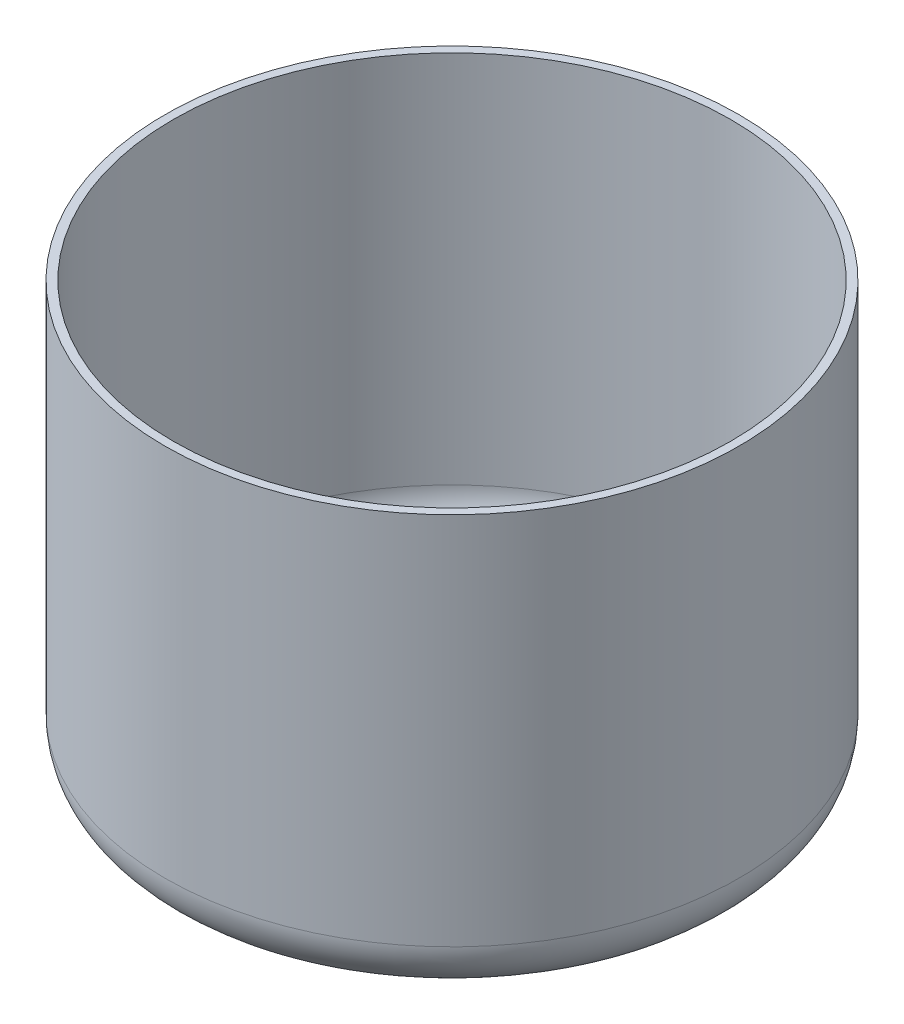
from build123d import *

# Parameters (mm, degrees)
SKETCH1_R           = 127
BOSS_EXTRUDE1_DEPTH = 190.5
FILLET1_R           = 20
SHELL1_T            = 3.81


with BuildPart() as part:
    # Sketch1 → Boss-Extrude1 (new body)
    with BuildSketch(Plane(origin=(0, 0, 0), x_dir=(1, 0, 0), z_dir=(0, 1, 0))):
        with Locations(Location((0, 0, 0), (0, 0, 270))):
            Circle(SKETCH1_R)
    extrude(amount=BOSS_EXTRUDE1_DEPTH)

    # Fillet1
    fillet1_edges = [part.edges().sort_by_distance(p)[0] for p in [
        (0, 0, -127),
    ]]
    fillet(fillet1_edges, radius=FILLET1_R)

    # Shell1
    shell1_openings = [part.faces().sort_by_distance(p)[0] for p in [
        (0, 190.5, 0),
    ]]
    offset(amount=SHELL1_T, openings=shell1_openings, kind=Kind.INTERSECTION)


solid = part.part
